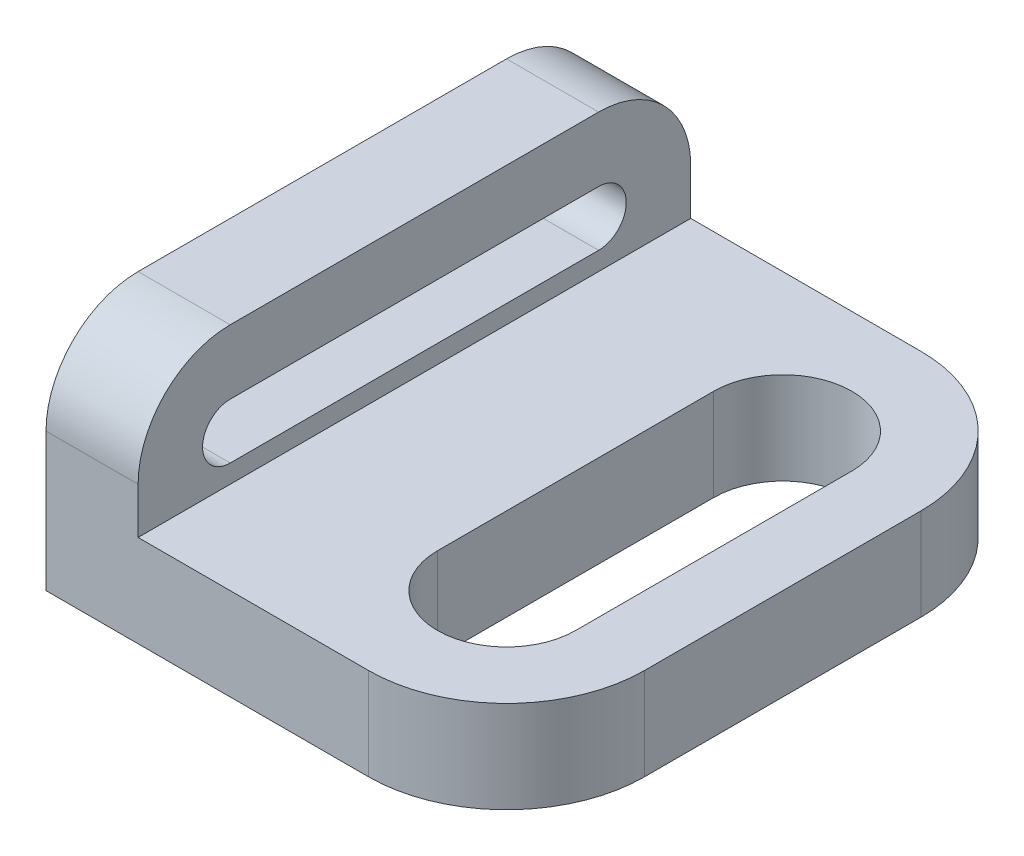
from build123d import *

# Parameters (mm, degrees)
SKETCH2_W           = 100
SKETCH2_H           = 120
BOSS_EXTRUDE1_DEPTH = 20
FILLET1_R           = 30
FILLET2_R           = 30
SKETCH3_W           = 20
SKETCH3_H           = 120
BOSS_EXTRUDE2_DEPTH = 30
CUT_EXTRUDE1_DEPTH  = 20
FILLET3_R           = 20


with BuildPart() as part:
    # Sketch2 → Boss-Extrude1 (new body)
    with BuildSketch(Plane(origin=(0, 0, 0), x_dir=(1, 0, 0), z_dir=(0, 1, 0))):
        Rectangle(SKETCH2_W, SKETCH2_H)
        with BuildLine():
            Line((35, 30), (35, -30))
            ThreePointArc((35, -30), (20, -45), (5, -30))
            Line((5, -30), (5, 30))
            ThreePointArc((5, 30), (20, 45), (35, 30))
        make_face(mode=Mode.SUBTRACT)
    extrude(amount=BOSS_EXTRUDE1_DEPTH)

    # Fillet1
    fillet1_edges = [part.edges().sort_by_distance(p)[0] for p in [
        (50, 10, -60),
    ]]
    fillet(fillet1_edges, radius=FILLET1_R)

    # Fillet2
    fillet2_edges = [part.edges().sort_by_distance(p)[0] for p in [
        (50, 10, 60),
    ]]
    fillet(fillet2_edges, radius=FILLET2_R)

    # Sketch3 → Boss-Extrude2 (add)
    with BuildSketch(Plane(origin=(0, 20, 0), x_dir=(1, 0, 0), z_dir=(0, 1, 0))):
        with Locations((-40, 0)):
            Rectangle(SKETCH3_W, SKETCH3_H)
    extrude(amount=BOSS_EXTRUDE2_DEPTH)

    # Sketch4 → Cut-Extrude1 (cut)
    with BuildSketch(Plane(origin=(-30, 0, 0), x_dir=(0, 0, -1), z_dir=(1, 0, 0))):
        with BuildLine():
            Line((-40, 36), (40, 36))
            ThreePointArc((40, 36), (46, 30), (40, 24))
            Line((40, 24), (-40, 24))
            ThreePointArc((-40, 24), (-46, 30), (-40, 36))
        make_face()
    extrude(amount=-CUT_EXTRUDE1_DEPTH, mode=Mode.SUBTRACT)

    # Fillet3
    fillet3_edges = [part.edges().sort_by_distance(p)[0] for p in [
        (-40, 50, -60),
        (-40, 50, 60),
    ]]
    fillet(fillet3_edges, radius=FILLET3_R)


solid = part.part
